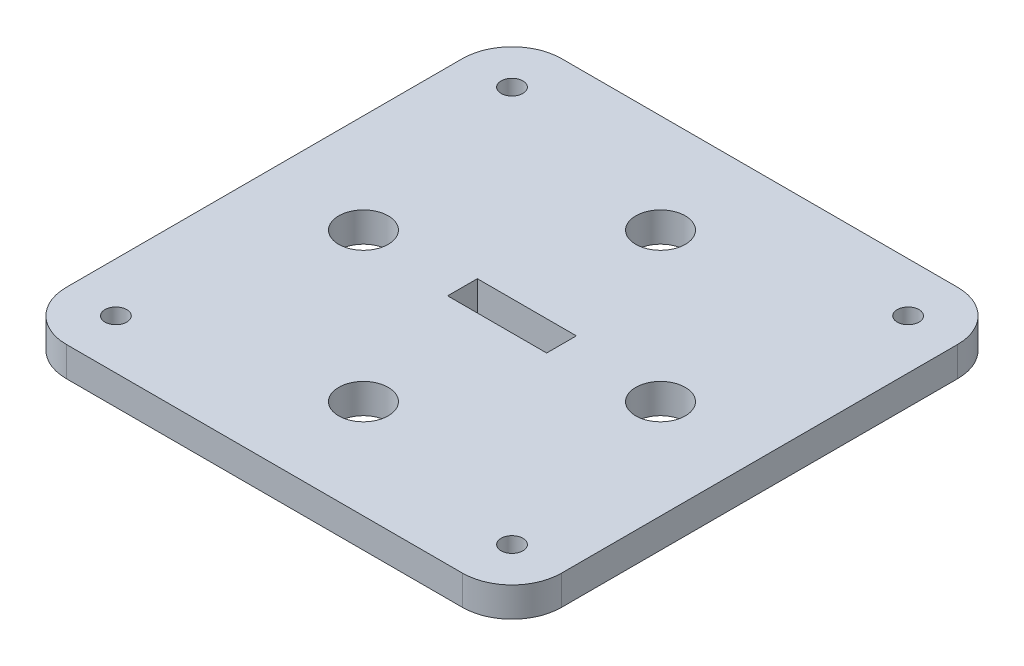
from build123d import *

# Parameters (mm, degrees)
SKETCH1_W           = 50
SKETCH1_H           = 50
SKETCH1_R           = 2.5
SKETCH1_R_2         = 1.1
SKETCH1_W_2         = 10
SKETCH1_H_2         = 3
BOSS_EXTRUDE1_DEPTH = 3
FILLET1_R           = 5


with BuildPart() as part:
    # Sketch1 → Boss-Extrude1 (new body)
    with BuildSketch(Plane(origin=(0, 0, 0), x_dir=(1, 0, 0), z_dir=(0, 1, 0))):
        Rectangle(SKETCH1_W, SKETCH1_H)
        with Locations(Location((-15, 0, 0), (0, 0, 270))):
            Circle(SKETCH1_R, mode=Mode.SUBTRACT)
        with Locations(Location((15, 0, 0), (0, 0, 90))):
            Circle(SKETCH1_R, mode=Mode.SUBTRACT)
        with Locations(Location((-20, 20, 0), (0, 0, 270))):
            Circle(SKETCH1_R_2, mode=Mode.SUBTRACT)
        with Locations(Location((20, 20, 0), (0, 0, 90))):
            Circle(SKETCH1_R_2, mode=Mode.SUBTRACT)
        with Locations(Location((20, -20, 0), (0, 0, 270))):
            Circle(SKETCH1_R_2, mode=Mode.SUBTRACT)
        with Locations(Location((-20, -20, 0), (0, 0, 90))):
            Circle(SKETCH1_R_2, mode=Mode.SUBTRACT)
        with Locations(Location((0, 15, 0), (0, 0, 270))):
            Circle(SKETCH1_R, mode=Mode.SUBTRACT)
        with Locations(Location((0, -15, 0), (0, 0, 90))):
            Circle(SKETCH1_R, mode=Mode.SUBTRACT)
        Rectangle(SKETCH1_W_2, SKETCH1_H_2, mode=Mode.SUBTRACT)
    extrude(amount=BOSS_EXTRUDE1_DEPTH)

    # Fillet1
    fillet1_edges = [part.edges().sort_by_distance(p)[0] for p in [
        (25, 1.5, 25),
        (-25, 1.5, 25),
        (-25, 1.5, -25),
        (25, 1.5, -25),
    ]]
    fillet(fillet1_edges, radius=FILLET1_R)


solid = part.part
